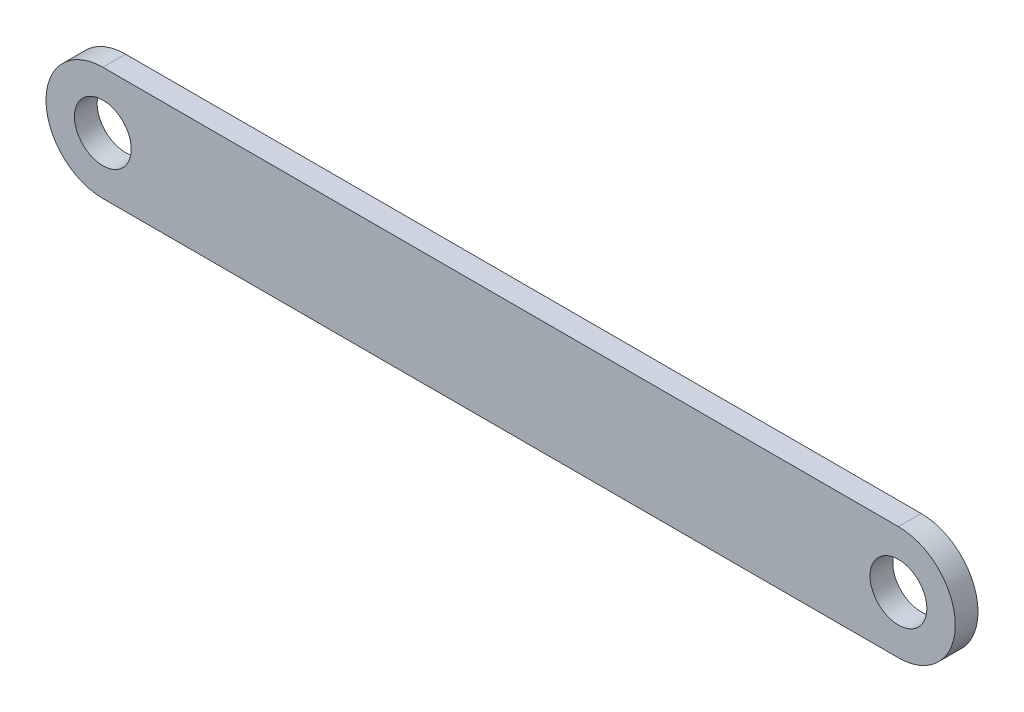
from build123d import *

# Parameters (mm, degrees)
SKETCH1_R           = 2.5
BOSS_EXTRUDE1_DEPTH = 2


with BuildPart() as part:
    # Sketch1 → Boss-Extrude1 (new body)
    with BuildSketch(Plane.XY):
        with BuildLine():
            Line((-52.442528736, 5), (17.557471264, 5))
            ThreePointArc((17.557471264, 5), (22.557471264, 0), (17.557471264, -5))
            Line((17.557471264, -5), (-52.442528736, -5))
            ThreePointArc((-52.442528736, -5), (-57.442528736, 0), (-52.442528736, 5))
        make_face()
        with Locations((-52.442528736, 0)):
            Circle(SKETCH1_R, mode=Mode.SUBTRACT)
        with Locations((17.557471264, 0)):
            Circle(SKETCH1_R, mode=Mode.SUBTRACT)
    extrude(amount=BOSS_EXTRUDE1_DEPTH)


solid = part.part
